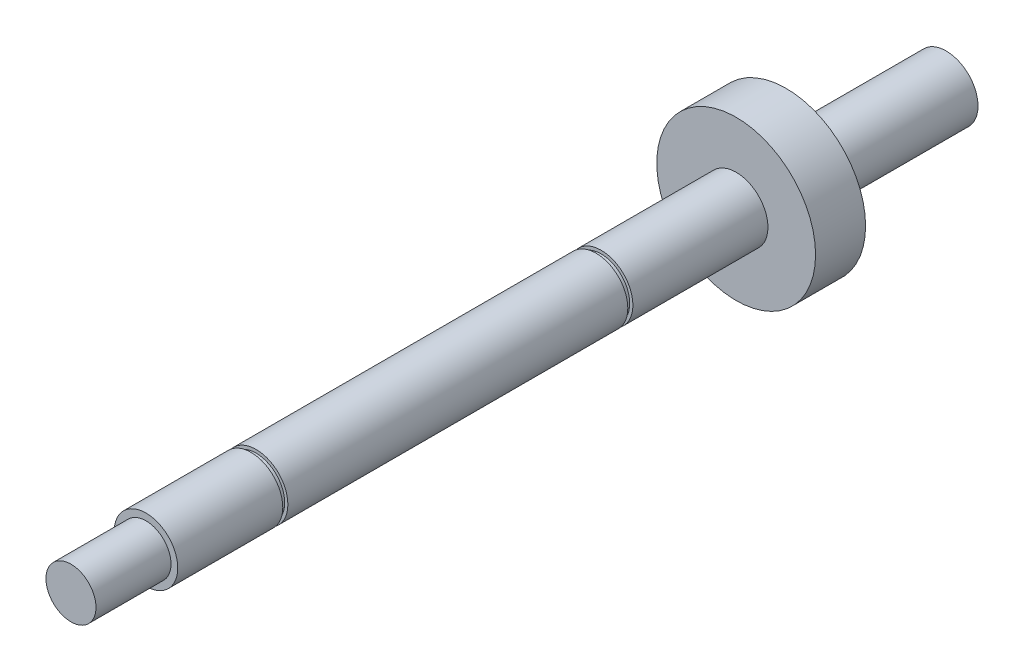
from build123d import *

# Parameters (mm, degrees)
SKETCH1_R           = 6.35
BOSS_EXTRUDE1_DEPTH = 175
CUT_EXTRUDE1_START  = 175
SKETCH2_R           = 8.212767486
SKETCH2_R_2         = 5
CUT_EXTRUDE1_DEPTH  = 15
BOSS_EXTRUDE2_START = 42
SKETCH3_R           = 15.875
BOSS_EXTRUDE2_DEPTH = 10
CUT_EXTRUDE2_START  = 69
SKETCH4_R           = 12.7
SKETCH4_R_2         = 5.715
CUT_EXTRUDE2_DEPTH  = 1.016
CUT_EXTRUDE3_START  = 137.984
SKETCH5_R           = 12.7
SKETCH5_R_2         = 5.715
CUT_EXTRUDE3_DEPTH  = 1.016


with BuildPart() as part:
    # Sketch1 → Boss-Extrude1 (new body)
    with BuildSketch(Plane.XY):
        Circle(SKETCH1_R)
    extrude(amount=BOSS_EXTRUDE1_DEPTH)

    # Sketch2 → Cut-Extrude1 (cut)
    with BuildSketch(Plane.XY.offset(CUT_EXTRUDE1_START)):
        Circle(SKETCH2_R)
        Circle(SKETCH2_R_2, mode=Mode.SUBTRACT)
    extrude(amount=-CUT_EXTRUDE1_DEPTH, mode=Mode.SUBTRACT)

    # Sketch3 → Boss-Extrude2 (add)
    with BuildSketch(Plane.XY.offset(BOSS_EXTRUDE2_START)):
        Circle(SKETCH3_R)
    extrude(amount=-BOSS_EXTRUDE2_DEPTH)

    # Sketch4 → Cut-Extrude2 (cut)
    with BuildSketch(Plane.XY.offset(CUT_EXTRUDE2_START)):
        Circle(SKETCH4_R)
        Circle(SKETCH4_R_2, mode=Mode.SUBTRACT)
    extrude(amount=CUT_EXTRUDE2_DEPTH, mode=Mode.SUBTRACT)

    # Sketch5 → Cut-Extrude3 (cut)
    with BuildSketch(Plane.XY.offset(CUT_EXTRUDE3_START)):
        Circle(SKETCH5_R)
        Circle(SKETCH5_R_2, mode=Mode.SUBTRACT)
    extrude(amount=CUT_EXTRUDE3_DEPTH, mode=Mode.SUBTRACT)


solid = part.part
